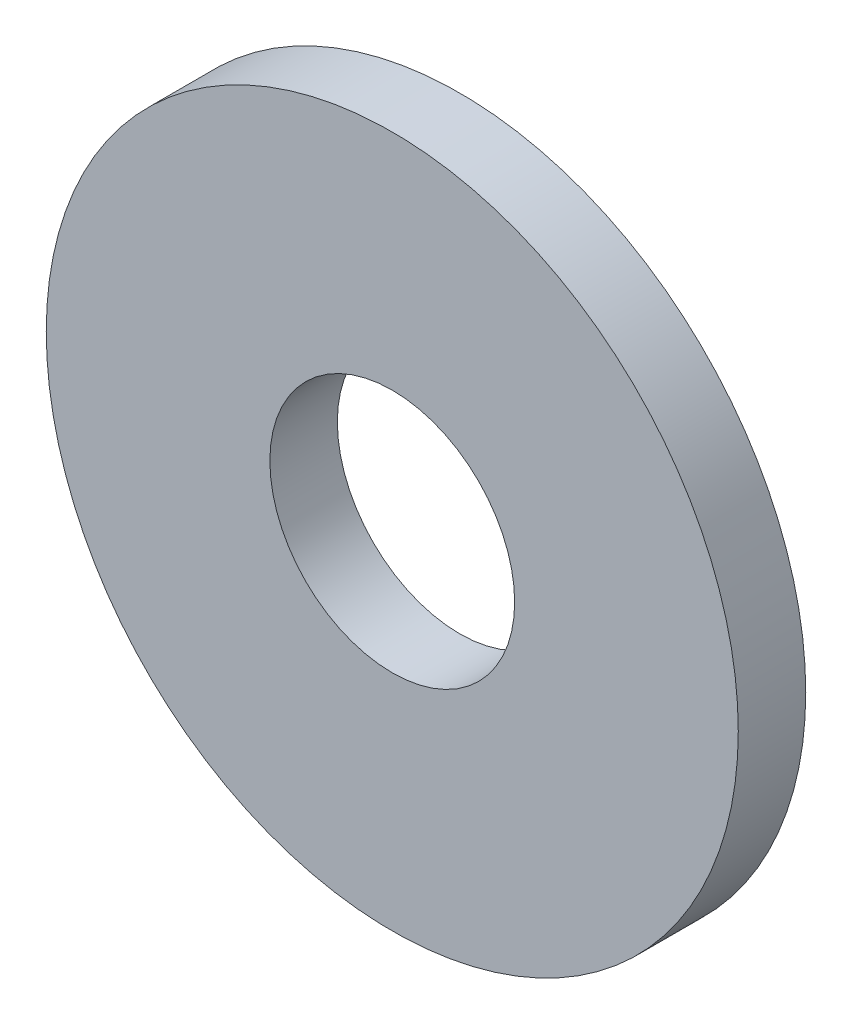
from build123d import *

# Parameters (mm, degrees)
SKETCH1_R           = 4.41
SKETCH1_R_2         = 1.56
BOSS_EXTRUDE1_DEPTH = 0.86


with BuildPart() as part:
    # Sketch1 → Boss-Extrude1 (new body)
    with BuildSketch(Plane.XY):
        Circle(SKETCH1_R)
        Circle(SKETCH1_R_2, mode=Mode.SUBTRACT)
    extrude(amount=BOSS_EXTRUDE1_DEPTH)


solid = part.part
